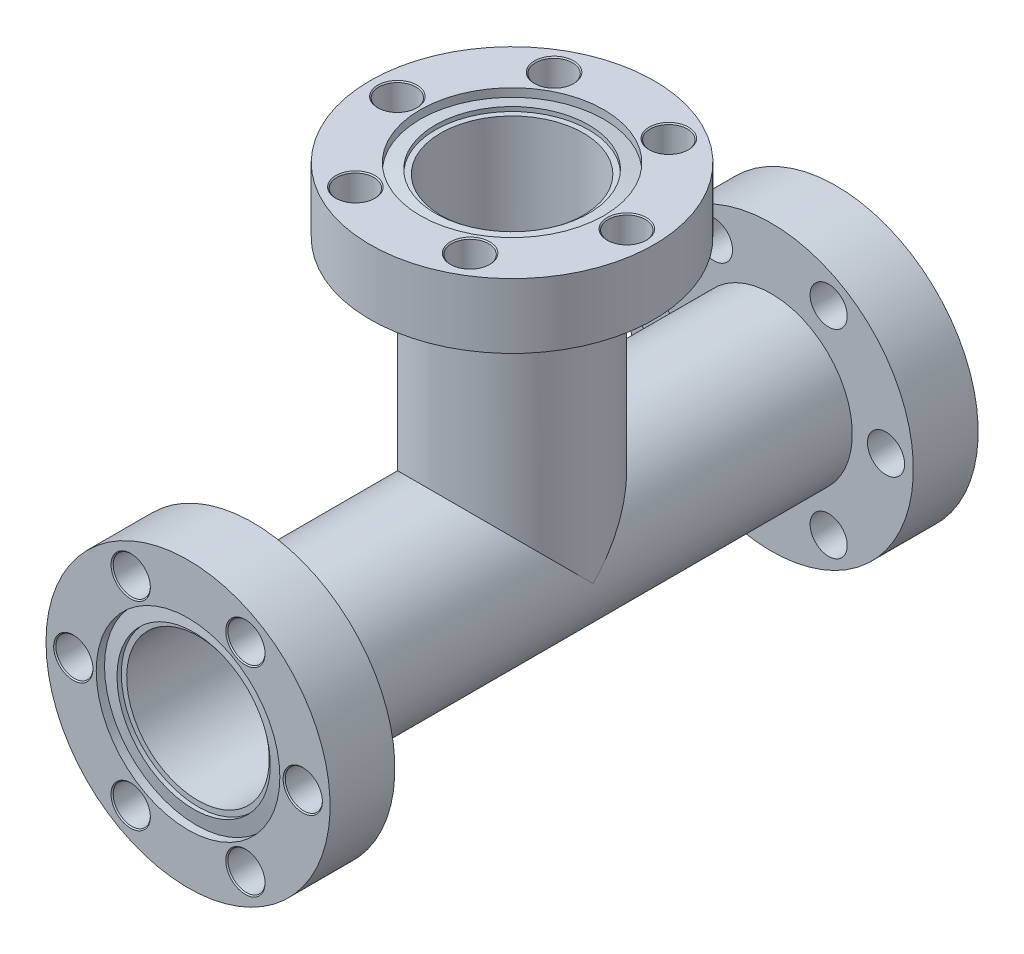
from build123d import *

# Parameters (mm, degrees)
CIRPATTERN1_COUNT  = 6
CIRPATTERN5_COUNT  = 3
CIRPATTERN5_ANGLE  = 180
SKETCH6_R          = 8.382
CUT_EXTRUDE1_DEPTH = 50.8
SKETCH7_R          = 8.382
CUT_EXTRUDE2_DEPTH = 50.8


with BuildPart() as part:
    # Sketch3 → Revolve1 (revolve)
    with BuildSketch(Plane(origin=(0, 0, 0), x_dir=(0, 0, -1), z_dir=(1, 0, 0))):
        Polygon((30.48, 9.525), (30.48, 16.7005), (38.1, 16.7005), (38.1, 10.795), (37.126090628, 10.795), (37.4396, 9.017), (36.9316, 9.017), (36.9316, 0), (0, 0), (0, 9.525), align=None)
    revolve1 = revolve(axis=Axis((0, 0, -80.9), (0, 0, 1)))

    # Sketch4 → 11/64 (0.17188) Diameter Hole1 (revolve, cut)
    with BuildSketch(Plane(origin=(-13.4874, 0, -38.1), x_dir=(0, 1, 0), z_dir=(1, 0, 0))):
        Polygon((0, 0), (0, 8.931604225), (2.182876, 7.62), (2.182876, 0.128524), (2.3114, 0), align=None)
    f_11_64_0_17188_diameter_hole1 = revolve(axis=Axis((-13.4874, 0, -44.45), (0, 0, 1)), mode=Mode.SUBTRACT)

    # CirPattern1: 11/64 (0.17188) Diameter Hole1 ×6 about axis
    cirpattern1_axis = Axis((0, 0, -80.9), (0, 0, 1))
    for i in range(1, CIRPATTERN1_COUNT):
        add(f_11_64_0_17188_diameter_hole1.rotate(cirpattern1_axis, i * 360 / CIRPATTERN1_COUNT), mode=Mode.SUBTRACT)

    # CirPattern5: Revolve1, 11/64 (0.17188) Diameter Hole1 ×3 about axis
    cirpattern5_axis = Axis((-14.524008421, 0, 0), (1, 0, 0))
    add([revolve1.rotate(cirpattern5_axis, i * CIRPATTERN5_ANGLE / (CIRPATTERN5_COUNT - 1)) for i in range(1, CIRPATTERN5_COUNT)])
    add([f_11_64_0_17188_diameter_hole1.rotate(cirpattern5_axis, i * CIRPATTERN5_ANGLE / (CIRPATTERN5_COUNT - 1)) for i in range(1, CIRPATTERN5_COUNT)], mode=Mode.SUBTRACT)

    # CirPattern5 copy 1 sketch → CirPattern5 copy 1 (revolve, cut)
    with BuildSketch(Plane(origin=(-6.7437, 38.1, -11.680431031), x_dir=(-0.8660254037844386, -1.745740669421567e-15, 0.5000000000000001), z_dir=(0.5000000000000001, -3.023711536277457e-15, 0.8660254037844386))):
        Polygon((0, 0), (0, 8.931604225), (2.182876, 7.62), (2.182876, 0.128524), (2.3114, 0), align=None)
    revolve(axis=Axis((-6.7437, 44.45, -11.680431031), (0, -1, 0)), mode=Mode.SUBTRACT)

    # CirPattern5 copy 2 sketch → CirPattern5 copy 2 (revolve, cut)
    with BuildSketch(Plane(origin=(-6.7437, 11.680431031, 38.1), x_dir=(-0.8660254037844386, -0.5000000000000001, -3.491481338843134e-15), z_dir=(0.5000000000000001, -0.8660254037844386, -6.047423072554914e-15))):
        Polygon((0, 0), (0, 8.931604225), (2.182876, 7.62), (2.182876, 0.128524), (2.3114, 0), align=None)
    revolve(axis=Axis((-6.7437, 11.680431031, 44.45), (0, 0, -1)), mode=Mode.SUBTRACT)

    # CirPattern5 copy 3 sketch → CirPattern5 copy 3 (revolve, cut)
    with BuildSketch(Plane(origin=(6.7437, 38.1, -11.680431031), x_dir=(-0.8660254037844387, 1.7457406694215659e-15, -0.4999999999999998), z_dir=(-0.4999999999999998, -3.0237115362774574e-15, 0.8660254037844387))):
        Polygon((0, 0), (0, 8.931604225), (2.182876, 7.62), (2.182876, 0.128524), (2.3114, 0), align=None)
    revolve(axis=Axis((6.7437, 44.45, -11.680431031), (0, -1, 0)), mode=Mode.SUBTRACT)

    # CirPattern5 copy 4 sketch → CirPattern5 copy 4 (revolve, cut)
    with BuildSketch(Plane(origin=(6.7437, 11.680431031, 38.1), x_dir=(-0.8660254037844387, 0.4999999999999998, 3.4914813388431318e-15), z_dir=(-0.4999999999999998, -0.8660254037844387, -6.047423072554915e-15))):
        Polygon((0, 0), (0, 8.931604225), (2.182876, 7.62), (2.182876, 0.128524), (2.3114, 0), align=None)
    revolve(axis=Axis((6.7437, 11.680431031, 44.45), (0, 0, -1)), mode=Mode.SUBTRACT)

    # CirPattern5 copy 5 sketch → CirPattern5 copy 5 (revolve, cut)
    with BuildSketch(Plane(origin=(13.4874, 38.1, 0), x_dir=(0, 0, -1), z_dir=(-1, 0, 0))):
        Polygon((0, 0), (0, 8.931604225), (2.182876, 7.62), (2.182876, 0.128524), (2.3114, 0), align=None)
    revolve(axis=Axis((13.4874, 44.45, 0), (0, -1, 0)), mode=Mode.SUBTRACT)

    # CirPattern5 copy 6 sketch → CirPattern5 copy 6 (revolve, cut)
    with BuildSketch(Plane(origin=(13.4874, 0, 38.1), x_dir=(0, 1, 0), z_dir=(-1, 0, 0))):
        Polygon((0, 0), (0, 8.931604225), (2.182876, 7.62), (2.182876, 0.128524), (2.3114, 0), align=None)
    revolve(axis=Axis((13.4874, 0, 44.45), (0, 0, -1)), mode=Mode.SUBTRACT)

    # CirPattern5 copy 7 sketch → CirPattern5 copy 7 (revolve, cut)
    with BuildSketch(Plane(origin=(6.7437, 38.1, 11.680431031), x_dir=(0.8660254037844384, 1.7457406694215683e-15, -0.5000000000000004), z_dir=(-0.5000000000000004, 3.0237115362774562e-15, -0.8660254037844384))):
        Polygon((0, 0), (0, 8.931604225), (2.182876, 7.62), (2.182876, 0.128524), (2.3114, 0), align=None)
    revolve(axis=Axis((6.7437, 44.45, 11.680431031), (0, -1, 0)), mode=Mode.SUBTRACT)

    # CirPattern5 copy 8 sketch → CirPattern5 copy 8 (revolve, cut)
    with BuildSketch(Plane(origin=(6.7437, -11.680431031, 38.1), x_dir=(0.8660254037844384, 0.5000000000000004, 3.4914813388431365e-15), z_dir=(-0.5000000000000004, 0.8660254037844384, 6.0474230725549124e-15))):
        Polygon((0, 0), (0, 8.931604225), (2.182876, 7.62), (2.182876, 0.128524), (2.3114, 0), align=None)
    revolve(axis=Axis((6.7437, -11.680431031, 44.45), (0, 0, -1)), mode=Mode.SUBTRACT)

    # CirPattern5 copy 9 sketch → CirPattern5 copy 9 (revolve, cut)
    with BuildSketch(Plane(origin=(-6.7437, 38.1, 11.680431031), x_dir=(0.8660254037844386, -1.745740669421567e-15, 0.5000000000000001), z_dir=(0.5000000000000001, 3.023711536277457e-15, -0.8660254037844386))):
        Polygon((0, 0), (0, 8.931604225), (2.182876, 7.62), (2.182876, 0.128524), (2.3114, 0), align=None)
    revolve(axis=Axis((-6.7437, 44.45, 11.680431031), (0, -1, 0)), mode=Mode.SUBTRACT)

    # CirPattern5 copy 10 sketch → CirPattern5 copy 10 (revolve, cut)
    with BuildSketch(Plane(origin=(-6.7437, -11.680431031, 38.1), x_dir=(0.8660254037844386, -0.5000000000000001, -3.491481338843134e-15), z_dir=(0.5000000000000001, 0.8660254037844386, 6.047423072554914e-15))):
        Polygon((0, 0), (0, 8.931604225), (2.182876, 7.62), (2.182876, 0.128524), (2.3114, 0), align=None)
    revolve(axis=Axis((-6.7437, -11.680431031, 44.45), (0, 0, -1)), mode=Mode.SUBTRACT)

    # Sketch6 → Cut-Extrude1 (cut, symmetric)
    with BuildSketch(Plane.XY):
        Circle(SKETCH6_R)
    extrude(amount=CUT_EXTRUDE1_DEPTH, both=True, mode=Mode.SUBTRACT)

    # Sketch7 → Cut-Extrude2 (cut)
    with BuildSketch(Plane(origin=(0, 0, 0), x_dir=(1, 0, 0), z_dir=(0, 1, 0))):
        Circle(SKETCH7_R)
    extrude(amount=CUT_EXTRUDE2_DEPTH, mode=Mode.SUBTRACT)


solid = part.part
